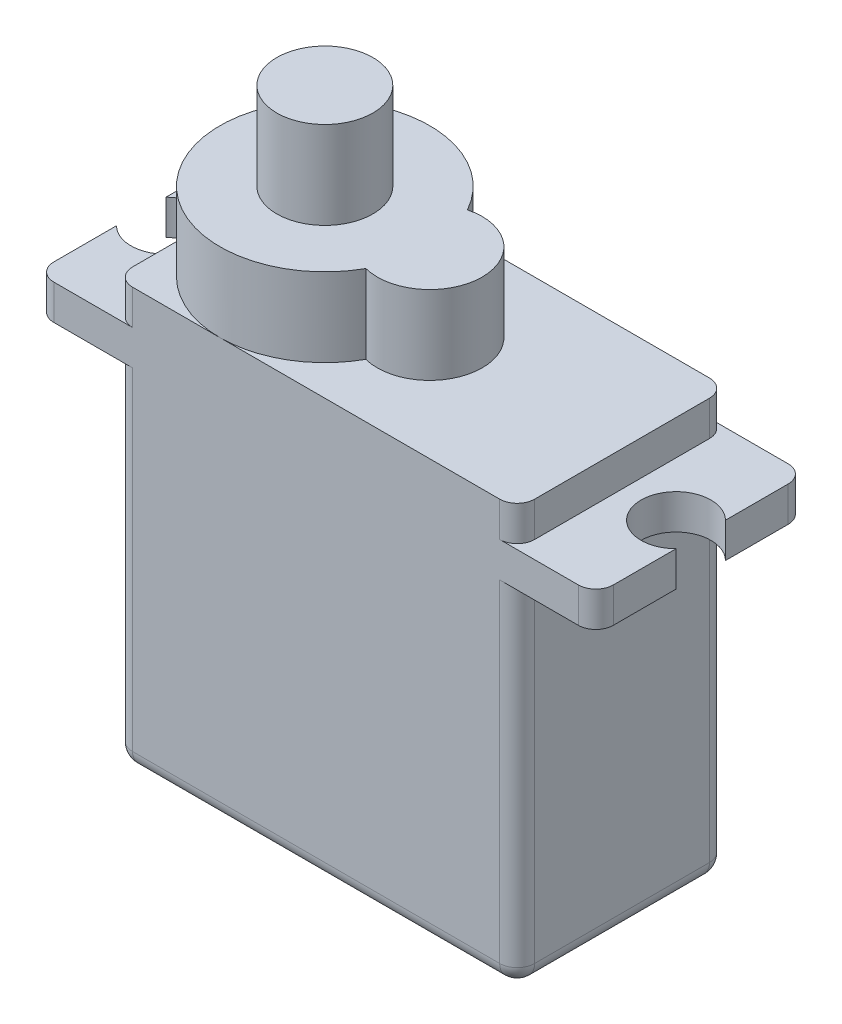
from build123d import *

# Parameters (mm, degrees)
SKETCH1_W           = 23
SKETCH1_H           = 12
BOSS_EXTRUDE1_DEPTH = 20
BOSS_EXTRUDE2_DEPTH = 2
SKETCH3_W           = 23
SKETCH3_H           = 12
BOSS_EXTRUDE3_DEPTH = 2
BOSS_EXTRUDE4_DEPTH = 4.5
SKETCH5_R           = 2.75
BOSS_EXTRUDE5_DEPTH = 5
FILLET1_R           = 1


with BuildPart() as part:
    # Sketch1 → Boss-Extrude1 (new body)
    with BuildSketch(Plane(origin=(0, 0, 0), x_dir=(1, 0, 0), z_dir=(0, 1, 0))):
        Rectangle(SKETCH1_W, SKETCH1_H)
    extrude(amount=BOSS_EXTRUDE1_DEPTH)

    # Sketch2 → Boss-Extrude2 (add)
    with BuildSketch(Plane(origin=(0, 20, 0), x_dir=(1, 0, 0), z_dir=(0, 1, 0))):
        with BuildLine():
            Line((-16, 6), (16, 6))
            Line((16, 6), (16, 1.414213562))
            ThreePointArc((16, 1.414213562), (12.585786438, 0), (16, -1.414213562))
            Line((16, -1.414213562), (16, -6))
            Line((16, -6), (-16, -6))
            Line((-16, -6), (-16, -1.414213562))
            ThreePointArc((-16, -1.414213562), (-12.585786438, 0), (-16, 1.414213562))
            Line((-16, 1.414213562), (-16, 6))
        make_face()
    extrude(amount=BOSS_EXTRUDE2_DEPTH)

    # Sketch3 → Boss-Extrude3 (add)
    with BuildSketch(Plane(origin=(0, 22, 0), x_dir=(1, 0, 0), z_dir=(0, 1, 0))):
        Rectangle(SKETCH3_W, SKETCH3_H)
    extrude(amount=BOSS_EXTRUDE3_DEPTH)

    # Sketch4 → Boss-Extrude4 (add)
    with BuildSketch(Plane(origin=(0, 24, 0), x_dir=(1, 0, 0), z_dir=(0, 1, 0))):
        with BuildLine():
            ThreePointArc((-0.25, 2.90473751), (-11.5, 0), (-0.25, -2.90473751))
            ThreePointArc((-0.25, -2.90473751), (3.5, 0), (-0.25, 2.90473751))
        make_face()
    extrude(amount=BOSS_EXTRUDE4_DEPTH)

    # Sketch5 → Boss-Extrude5 (add)
    with BuildSketch(Plane(origin=(0, 28.5, 0), x_dir=(1, 0, 0), z_dir=(0, 1, 0))):
        with Locations(Location((-5.5, 0, 0), (0, 0, 270))):
            Circle(SKETCH5_R)
    extrude(amount=BOSS_EXTRUDE5_DEPTH)

    # Fillet1
    fillet1_edges = [part.edges().sort_by_distance(p)[0] for p in [
        (16, 21, 6),
        (16, 21, -6),
        (-16, 21, -6),
        (-16, 21, 6),
        (11.5, 23, 6),
        (11.5, 23, -6),
        (-11.5, 23, -6),
        (-11.5, 23, 6),
        (0, 0, 6),
        (-11.5, 0, 0),
        (0, 0, -6),
        (11.5, 0, 0),
        (11.5, 10, 6),
        (-11.5, 10, 6),
        (-11.5, 10, -6),
        (11.5, 10, -6),
    ]]
    fillet(fillet1_edges, radius=FILLET1_R)


solid = part.part
